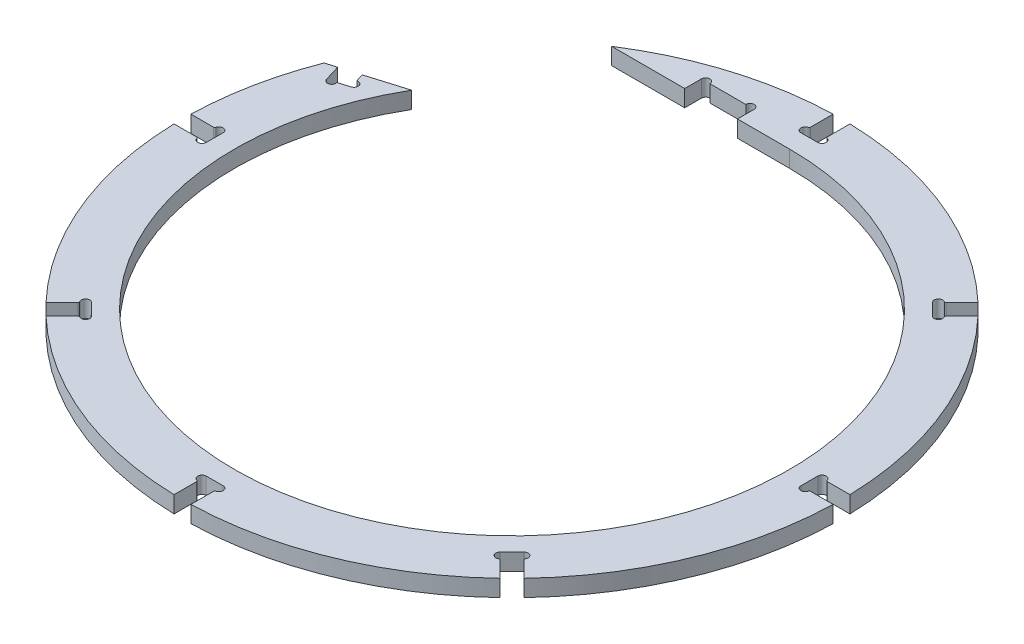
from build123d import *

# Parameters (mm, degrees)
SKETCH1_R                = 250
SKETCH1_R_2              = 210.5
BOSS_EXTRUDE1_DEPTH      = 12.7
CUT_EXTRUDE1_DEPTH       = 354.781415566
FILLET1_R                = 1
CIRPATTERN1_COUNT        = 8
FILLET1_OF_CIRPATTERN1_R = 1
CUT_EXTRUDE3_DEPTH       = 354.665618911
CUT_EXTRUDE4_DEPTH       = 354.665618911


with BuildPart() as part:
    # Sketch1 → Boss-Extrude1 (new body)
    with BuildSketch(Plane(origin=(0, 0, 0), x_dir=(1, 0, 0), z_dir=(0, 1, 0))):
        with Locations(Location((0, 0, 0), (0, 0, 270))):
            Circle(SKETCH1_R)
        with Locations(Location((0, 0, 0), (0, 0, 270))):
            Circle(SKETCH1_R_2, mode=Mode.SUBTRACT)
    extrude(amount=BOSS_EXTRUDE1_DEPTH)

    # Sketch2 → Cut-Extrude1 (cut, through all)
    with BuildSketch(Plane(origin=(0, 12.7, 0), x_dir=(1, 0, 0), z_dir=(0, 1, 0))):
        with BuildLine():
            Line((6.4, 225.5), (-6.4, 225.5))
            ThreePointArc((-6.4, 225.5), (-9.6, 228.7), (-6.4, 231.9))
            Line((-6.4, 231.9), (-6.4, 250))
            Line((-6.4, 250), (6.4, 250))
            Line((6.4, 250), (6.4, 231.9))
            ThreePointArc((6.4, 231.9), (9.6, 228.7), (6.4, 225.5))
        make_face()
    cut_extrude1 = extrude(amount=-CUT_EXTRUDE1_DEPTH, mode=Mode.SUBTRACT)

    # Fillet1
    fillet1_edges = [part.edges().sort_by_distance(p)[0] for p in [
        (-6.4, 6.35, -231.9),
        (6.4, 6.35, -231.9),
    ]]
    fillet(fillet1_edges, radius=FILLET1_R)

    # CirPattern1: Cut-Extrude1 ×8 about axis
    cirpattern1_axis = Axis((0, 0, 0), (0, 1, 0))
    for i in range(1, CIRPATTERN1_COUNT):
        add(cut_extrude1.rotate(cirpattern1_axis, i * 360 / CIRPATTERN1_COUNT), mode=Mode.SUBTRACT)

    # Fillet1 of CirPattern1
    fillet1_of_cirpattern1_edges = [part.edges().sort_by_distance(p)[0] for p in [
        (-168.503545957, 6.35, -159.452579158),
        (-159.452579158, 6.35, -168.503545957),
        (-231.9, 6.35, 6.4),
        (-231.9, 6.35, -6.4),
        (-159.452579158, 6.35, 168.503545957),
        (-168.503545957, 6.35, 159.452579158),
        (6.4, 6.35, 231.9),
        (-6.4, 6.35, 231.9),
        (168.503545957, 6.35, 159.452579158),
        (159.452579158, 6.35, 168.503545957),
        (231.9, 6.35, -6.4),
        (231.9, 6.35, 6.4),
        (159.452579158, 6.35, -168.503545957),
        (168.503545957, 6.35, -159.452579158),
    ]]
    fillet(fillet1_of_cirpattern1_edges, radius=FILLET1_OF_CIRPATTERN1_R)

    # Sketch5 → Cut-Extrude3 (cut, through all)
    with BuildSketch(Plane(origin=(0, 12.7, 0), x_dir=(1, 0, 0), z_dir=(0, 1, 0))):
        Polygon((0, 210.5), (-248.044523643, 210.5), (-248.044523643, 90.5), (-233.044523643, 90.5), (0, 160.5), align=None)
    extrude(amount=-CUT_EXTRUDE3_DEPTH, mode=Mode.SUBTRACT)

    # Sketch6 → Cut-Extrude4 (cut, through all)
    with BuildSketch(Plane(origin=(0, 12.7, 0), x_dir=(1, 0, 0), z_dir=(0, 1, 0))):
        with BuildLine():
            Line((-39.506660352, 210.5), (-39.506660352, 223.2))
            ThreePointArc((-39.506660352, 223.2), (-42.706660352, 226.4), (-45.906660352, 223.2))
            Line((-45.906660352, 223.2), (-73.106660352, 223.2))
            ThreePointArc((-73.106660352, 223.2), (-76.306660352, 226.4), (-79.506660352, 223.2))
            Line((-79.506660352, 223.2), (-79.506660352, 210.5))
            Line((-79.506660352, 210.5), (-39.506660352, 210.5))
        make_face()
        with BuildLine():
            Line((-225.095552296, 92.887646728), (-221.442085646, 80.724498227))
            ThreePointArc((-221.442085646, 80.724498227), (-217.45679679, 78.580326423), (-215.312624985, 82.565615279))
            Line((-215.312624985, 82.565615279), (-207.076162221, 85.039616318))
            ThreePointArc((-207.076162221, 85.039616318), (-204.931990416, 89.024905174), (-208.917279273, 91.169076979))
            Line((-208.917279273, 91.169076979), (-210.72962887, 97.202764818))
            Line((-210.72962887, 97.202764818), (-225.095552296, 92.887646728))
        make_face()
    extrude(amount=-CUT_EXTRUDE4_DEPTH, mode=Mode.SUBTRACT)


solid = part.part
